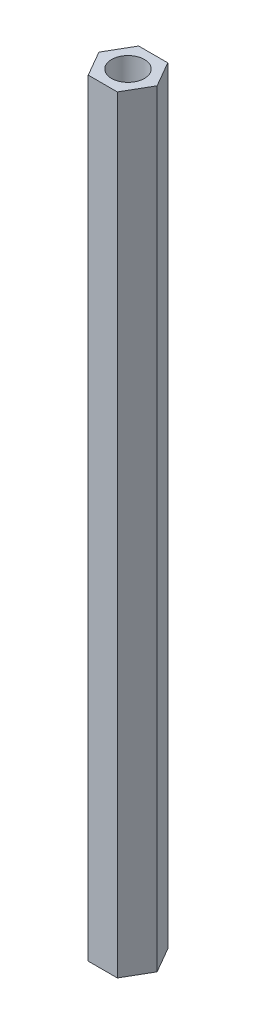
from build123d import *

# Parameters (mm, degrees)
SKETCH1_R           = 1.5
BOSS_EXTRUDE1_DEPTH = 70


with BuildPart() as part:
    # Sketch1 → Boss-Extrude1 (new body)
    with BuildSketch(Plane(origin=(0, 0, 0), x_dir=(1, 0, 0), z_dir=(0, 1, 0))):
        Polygon((2.655811238, 0), (1.327905619, 2.3), (-1.327905619, 2.3), (-2.655811238, 0), (-1.327905619, -2.3), (1.327905619, -2.3), align=None)
        with Locations(Location((0, 0, 0), (0, 0, 270))):
            Circle(SKETCH1_R, mode=Mode.SUBTRACT)
    extrude(amount=BOSS_EXTRUDE1_DEPTH)


solid = part.part
